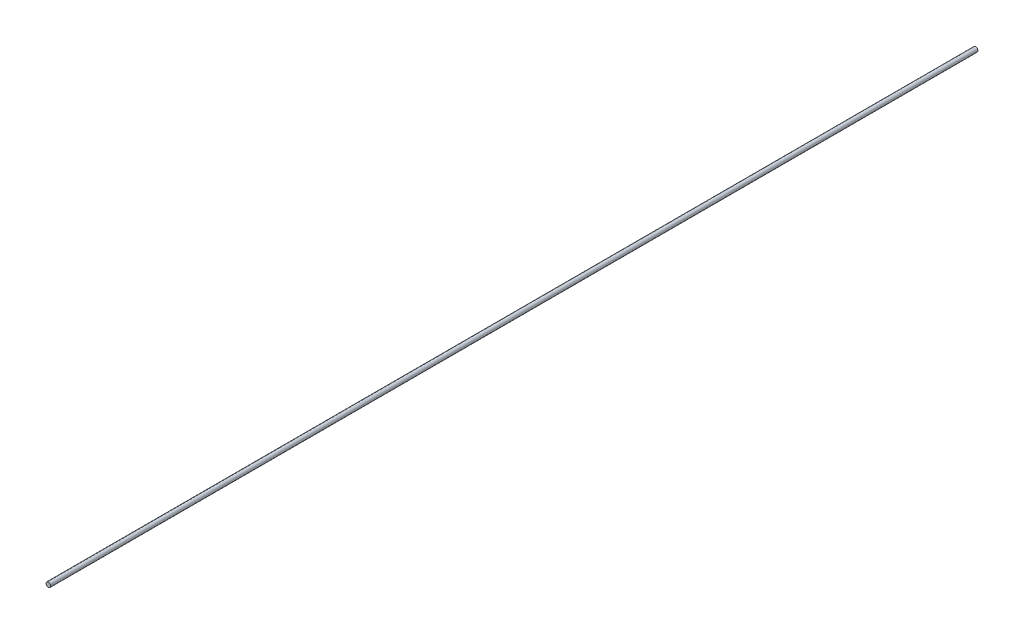
from build123d import *

# Parameters (mm, degrees)
SKETCH1_R           = 5
BOSS_EXTRUDE1_DEPTH = 1000.467


with BuildPart() as part:
    # Sketch1 → Boss-Extrude1 (new body)
    with BuildSketch(Plane.XY):
        Circle(SKETCH1_R)
    extrude(amount=BOSS_EXTRUDE1_DEPTH)

    # Mirror1: part across plane


with BuildPart() as part_1:
    add(part.part)
    add(part.part.mirror(Plane.XY))


solid = part_1.part
